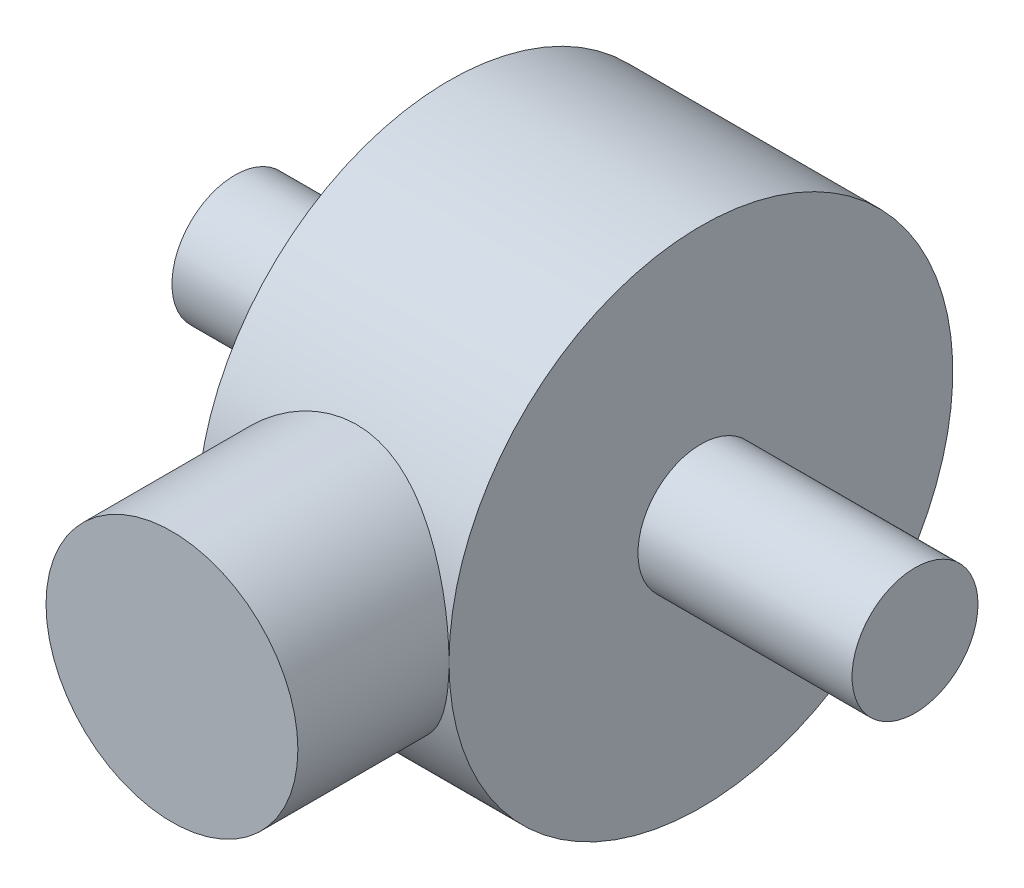
from build123d import *

# Parameters (mm, degrees)
CROQUIS1_R                   = 25.4
SALIENTE_EXTRUIR1_DEPTH      = 12.7
SALIENTE_EXTRUIR2_REACH      = 73.887
SALIENTE_EXTRUIR2_END_RADIUS = 25.4
CROQUIS2_R                   = 12.7
CROQUIS6_R                   = 6.35
SALIENTE_EXTRUIR5_DEPTH      = 34.29


with BuildPart() as part:
    # Croquis1 → Saliente-Extruir1 (new, symmetric)
    with BuildSketch(Plane(origin=(0, 0, 0), x_dir=(0, 0, -1), z_dir=(1, 0, 0))):
        Circle(CROQUIS1_R)
    extrude(amount=SALIENTE_EXTRUIR1_DEPTH, both=True)

    # Saliente-Extruir2: up to this cylinder (the profile starts outside it)
    saliente_extruir2_end = Plane(origin=(0, 0, 0), z_dir=(-1, 0, 0)) * Cylinder(SALIENTE_EXTRUIR2_END_RADIUS, 199.574, mode=Mode.PRIVATE)
    # Croquis2 → Saliente-Extruir2 (add, up to the surface)
    with BuildSketch(Plane.XY.offset(40.64), mode=Mode.PRIVATE) as saliente_extruir2_sk1:
        Circle(CROQUIS2_R)
    saliente_extruir2_tool1 = extrude(saliente_extruir2_sk1.sketch, amount=-SALIENTE_EXTRUIR2_REACH, mode=Mode.PRIVATE) - saliente_extruir2_end
    add(saliente_extruir2_tool1.solids().sort_by_distance((0, 0, 40.64))[0])

    # Croquis6 → Saliente-Extruir5 (add, symmetric)
    with BuildSketch(Plane(origin=(0, 0, 0), x_dir=(0, 0, -1), z_dir=(1, 0, 0))):
        Circle(CROQUIS6_R)
    extrude(amount=SALIENTE_EXTRUIR5_DEPTH, both=True)


solid = part.part
